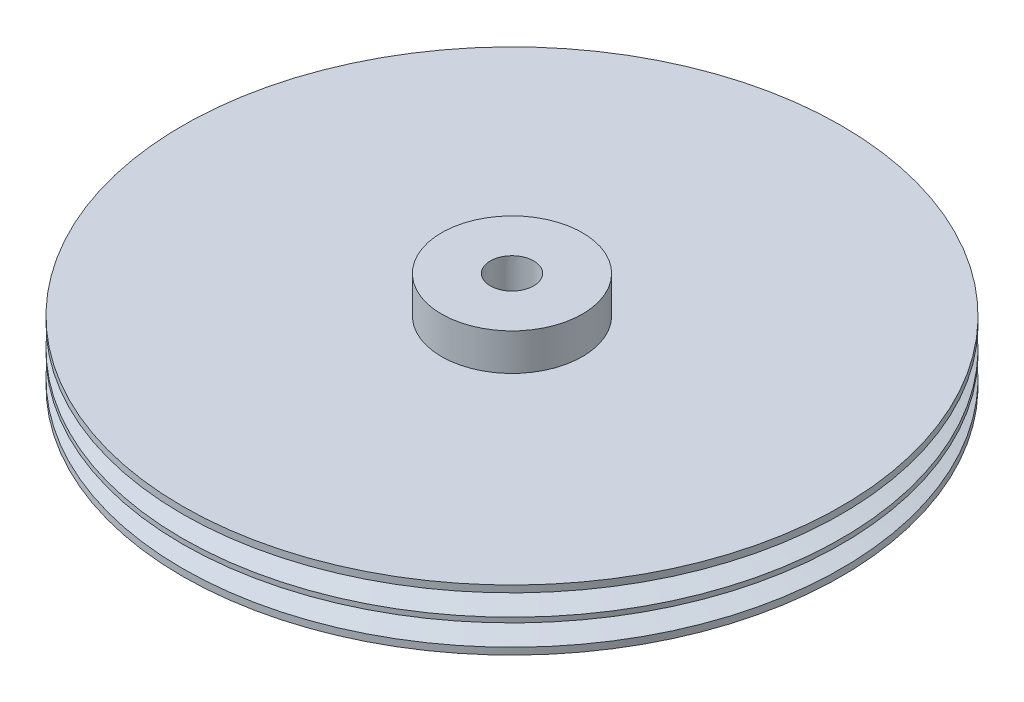
from build123d import *


with BuildPart() as part:
    # Sketch1 → Revolve1 (revolve)
    with BuildSketch(Plane.XY, mode=Mode.PRIVATE) as revolve1_sk:
        Polygon((10, 45), (10, 0), (152, 0), (152, 3.138538637), (141, 6.501576133), (141, 9.498423867), (152, 12.861461363), (152, 15.138538637), (141, 18.501576133), (141, 21.498423867), (152, 24.861461363), (152, 28), (32.5, 28), (32.5, 45), align=None)
    revolve(revolve1_sk.sketch.rotate(Axis((0, 18.798504309, 0), (0, -1, 0)), 90), axis=Axis((0, 18.798504309, 0), (0, -1, 0)))


solid = part.part
